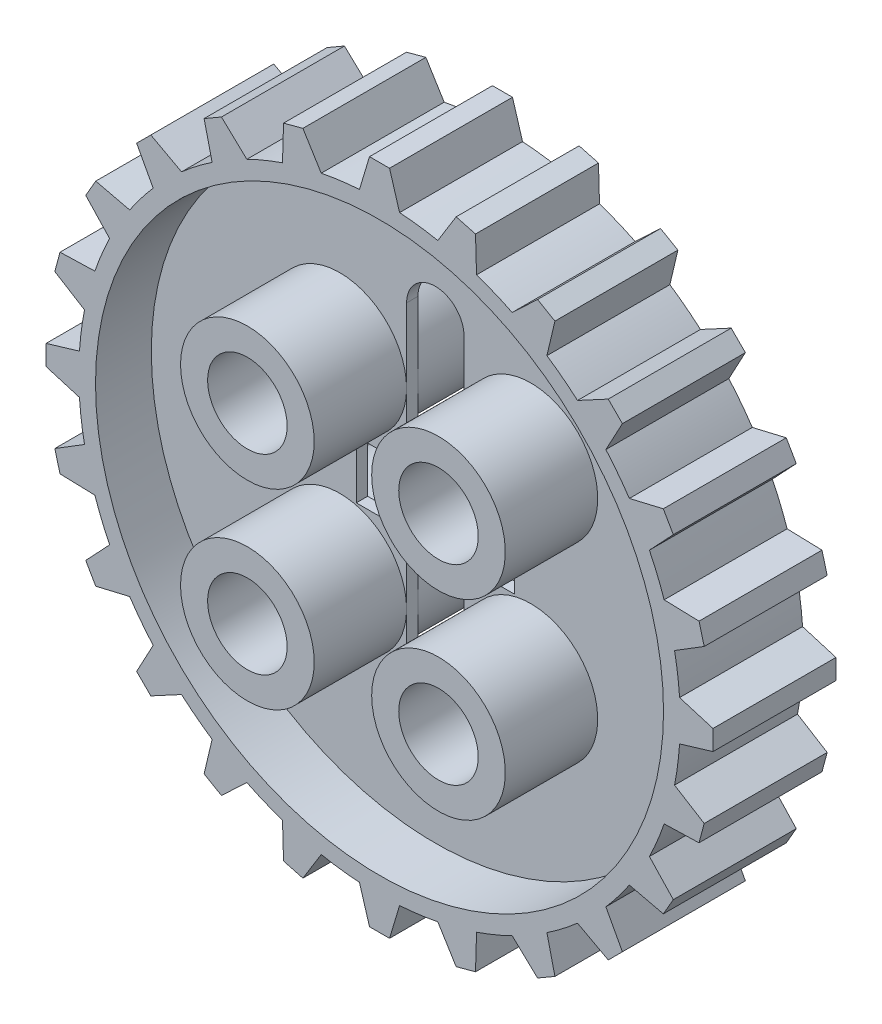
from build123d import *

# Parameters (mm, degrees)
BOSS_EXTRUDE1_DEPTH = 3.68
SKETCH2_R           = 8.5
CUT_EXTRUDE1_DEPTH  = 1.67
CUT_EXTRUDE2_START  = -1.67
SKETCH3_R           = 8.5
CUT_EXTRUDE2_DEPTH  = 1.67
CUT_EXTRUDE3_DEPTH  = 15.256227093
SKETCH17_8_R        = 2
SKETCH17_8_R_2      = 1.19
BOSS_EXTRUDE6_DEPTH = 3.105


with BuildPart() as part:
    # Sketch1 → Boss-Extrude1 (new body)
    with BuildSketch(Plane.XY):
        with BuildLine():
            Line((0.6, 8.979977728), (0.3, 9.979977728))
            Line((0.3, 9.979977728), (-0.3, 9.979977728))
            Line((-0.3, 9.979977728), (-0.6, 8.979977728))
            ThreePointArc((-0.6, 8.979977728), (-1.17473573, 8.923003752), (-1.744633765, 8.829283834))
            Line((-1.744633765, 8.829283834), (-2.293230558, 9.717563947))
            Line((-2.293230558, 9.717563947), (-2.872786054, 9.56227252))
            Line((-2.872786054, 9.56227252), (-2.903744756, 8.51870098))
            ThreePointArc((-2.903744756, 8.51870098), (-3.444150891, 8.314915793), (-3.970373622, 8.076888838))
            Line((-3.970373622, 8.076888838), (-4.730181243, 8.792914242))
            Line((-4.730181243, 8.792914242), (-5.249796485, 8.492914242))
            Line((-5.249796485, 8.492914242), (-5.009604106, 7.476888838))
            ThreePointArc((-5.009604106, 7.476888838), (-5.478852861, 7.140180063), (-5.925539078, 6.774067215))
            Line((-5.925539078, 6.774067215), (-6.844777893, 7.269041962))
            Line((-6.844777893, 7.269041962), (-7.269041962, 6.844777893))
            Line((-7.269041962, 6.844777893), (-6.774067215, 5.925539078))
            ThreePointArc((-6.774067215, 5.925539078), (-7.140180063, 5.478852861), (-7.476888838, 5.009604106))
            Line((-7.476888838, 5.009604106), (-8.492914242, 5.249796485))
            Line((-8.492914242, 5.249796485), (-8.792914242, 4.730181243))
            Line((-8.792914242, 4.730181243), (-8.076888838, 3.970373622))
            ThreePointArc((-8.076888838, 3.970373622), (-8.314915793, 3.444150891), (-8.51870098, 2.903744756))
            Line((-8.51870098, 2.903744756), (-9.56227252, 2.872786054))
            Line((-9.56227252, 2.872786054), (-9.717563947, 2.293230558))
            Line((-9.717563947, 2.293230558), (-8.829283834, 1.744633765))
            ThreePointArc((-8.829283834, 1.744633765), (-8.923003752, 1.17473573), (-8.979977728, 0.6))
            Line((-8.979977728, 0.6), (-9.979977728, 0.3))
            Line((-9.979977728, 0.3), (-9.979977728, -0.3))
            Line((-9.979977728, -0.3), (-8.979977728, -0.6))
            ThreePointArc((-8.979977728, -0.6), (-8.923003752, -1.17473573), (-8.829283834, -1.744633765))
            Line((-8.829283834, -1.744633765), (-9.717563947, -2.293230558))
            Line((-9.717563947, -2.293230558), (-9.56227252, -2.872786054))
            Line((-9.56227252, -2.872786054), (-8.51870098, -2.903744756))
            ThreePointArc((-8.51870098, -2.903744756), (-8.314915793, -3.444150891), (-8.076888838, -3.970373622))
            Line((-8.076888838, -3.970373622), (-8.792914242, -4.730181243))
            Line((-8.792914242, -4.730181243), (-8.492914242, -5.249796485))
            Line((-8.492914242, -5.249796485), (-7.476888838, -5.009604106))
            ThreePointArc((-7.476888838, -5.009604106), (-7.140180063, -5.478852861), (-6.774067215, -5.925539078))
            Line((-6.774067215, -5.925539078), (-7.269041962, -6.844777893))
            Line((-7.269041962, -6.844777893), (-6.844777893, -7.269041962))
            Line((-6.844777893, -7.269041962), (-5.925539078, -6.774067215))
            ThreePointArc((-5.925539078, -6.774067215), (-5.478852861, -7.140180063), (-5.009604106, -7.476888838))
            Line((-5.009604106, -7.476888838), (-5.249796485, -8.492914242))
            Line((-5.249796485, -8.492914242), (-4.730181243, -8.792914242))
            Line((-4.730181243, -8.792914242), (-3.970373622, -8.076888838))
            ThreePointArc((-3.970373622, -8.076888838), (-3.444150891, -8.314915793), (-2.903744756, -8.51870098))
            Line((-2.903744756, -8.51870098), (-2.872786054, -9.56227252))
            Line((-2.872786054, -9.56227252), (-2.293230558, -9.717563947))
            Line((-2.293230558, -9.717563947), (-1.744633765, -8.829283834))
            ThreePointArc((-1.744633765, -8.829283834), (-1.17473573, -8.923003752), (-0.6, -8.979977728))
            Line((-0.6, -8.979977728), (-0.3, -9.979977728))
            Line((-0.3, -9.979977728), (0.3, -9.979977728))
            Line((0.3, -9.979977728), (0.6, -8.979977728))
            ThreePointArc((0.6, -8.979977728), (1.17473573, -8.923003752), (1.744633765, -8.829283834))
            Line((1.744633765, -8.829283834), (2.293230558, -9.717563947))
            Line((2.293230558, -9.717563947), (2.872786054, -9.56227252))
            Line((2.872786054, -9.56227252), (2.903744756, -8.51870098))
            ThreePointArc((2.903744756, -8.51870098), (3.444150891, -8.314915793), (3.970373622, -8.076888838))
            Line((3.970373622, -8.076888838), (4.730181243, -8.792914242))
            Line((4.730181243, -8.792914242), (5.249796485, -8.492914242))
            Line((5.249796485, -8.492914242), (5.009604106, -7.476888838))
            ThreePointArc((5.009604106, -7.476888838), (5.478852861, -7.140180063), (5.925539078, -6.774067215))
            Line((5.925539078, -6.774067215), (6.844777893, -7.269041962))
            Line((6.844777893, -7.269041962), (7.269041962, -6.844777893))
            Line((7.269041962, -6.844777893), (6.774067215, -5.925539078))
            ThreePointArc((6.774067215, -5.925539078), (7.140180063, -5.478852861), (7.476888838, -5.009604106))
            Line((7.476888838, -5.009604106), (8.492914242, -5.249796485))
            Line((8.492914242, -5.249796485), (8.792914242, -4.730181243))
            Line((8.792914242, -4.730181243), (8.076888838, -3.970373622))
            ThreePointArc((8.076888838, -3.970373622), (8.314915793, -3.444150891), (8.51870098, -2.903744756))
            Line((8.51870098, -2.903744756), (9.56227252, -2.872786054))
            Line((9.56227252, -2.872786054), (9.717563947, -2.293230558))
            Line((9.717563947, -2.293230558), (8.829283834, -1.744633765))
            ThreePointArc((8.829283834, -1.744633765), (8.923003752, -1.17473573), (8.979977728, -0.6))
            Line((8.979977728, -0.6), (9.979977728, -0.3))
            Line((9.979977728, -0.3), (9.979977728, 0.3))
            Line((9.979977728, 0.3), (8.979977728, 0.6))
            ThreePointArc((8.979977728, 0.6), (8.923003752, 1.17473573), (8.829283834, 1.744633765))
            Line((8.829283834, 1.744633765), (9.717563947, 2.293230558))
            Line((9.717563947, 2.293230558), (9.56227252, 2.872786054))
            Line((9.56227252, 2.872786054), (8.51870098, 2.903744756))
            ThreePointArc((8.51870098, 2.903744756), (8.314915793, 3.444150891), (8.076888838, 3.970373622))
            Line((8.076888838, 3.970373622), (8.792914242, 4.730181243))
            Line((8.792914242, 4.730181243), (8.492914242, 5.249796485))
            Line((8.492914242, 5.249796485), (7.476888838, 5.009604106))
            ThreePointArc((7.476888838, 5.009604106), (7.140180063, 5.478852861), (6.774067215, 5.925539078))
            Line((6.774067215, 5.925539078), (7.269041962, 6.844777893))
            Line((7.269041962, 6.844777893), (6.844777893, 7.269041962))
            Line((6.844777893, 7.269041962), (5.925539078, 6.774067215))
            ThreePointArc((5.925539078, 6.774067215), (5.478852861, 7.140180063), (5.009604106, 7.476888838))
            Line((5.009604106, 7.476888838), (5.249796485, 8.492914242))
            Line((5.249796485, 8.492914242), (4.730181243, 8.792914242))
            Line((4.730181243, 8.792914242), (3.970373622, 8.076888838))
            ThreePointArc((3.970373622, 8.076888838), (3.444150891, 8.314915793), (2.903744756, 8.51870098))
            Line((2.903744756, 8.51870098), (2.872786054, 9.56227252))
            Line((2.872786054, 9.56227252), (2.293230558, 9.717563947))
            Line((2.293230558, 9.717563947), (1.744633765, 8.829283834))
            ThreePointArc((1.744633765, 8.829283834), (1.17473573, 8.923003752), (0.6, 8.979977728))
        make_face()
    extrude(amount=BOSS_EXTRUDE1_DEPTH)

    # Sketch2 → Cut-Extrude1 (cut)
    with BuildSketch(Plane.XY.offset(3.68)):
        Circle(SKETCH2_R)
    extrude(amount=-CUT_EXTRUDE1_DEPTH, mode=Mode.SUBTRACT)

    # Sketch3 → Cut-Extrude2 (cut)
    with BuildSketch(Plane(origin=(0, 0, 0), x_dir=(-1, 0, 0), z_dir=(0, 0, -1)).offset(CUT_EXTRUDE2_START)):
        Circle(SKETCH3_R)
    extrude(amount=CUT_EXTRUDE2_DEPTH, mode=Mode.SUBTRACT)

    # Sketch17 → Cut-Extrude3 (cut, through all)
    with BuildSketch(Plane(origin=(0, 0, 1.67), x_dir=(-1, 0, 0), z_dir=(0, 0, -1))):
        with BuildLine():
            ThreePointArc((-0.86, -5.075), (0, -5.935), (0.86, -5.075))
            Line((0.86, -5.075), (0.86, -0.86))
            Line((0.86, -0.86), (2.365, -0.86))
            Line((2.365, -0.86), (2.365, 0.86))
            Line((2.365, 0.86), (0.86, 0.86))
            Line((0.86, 0.86), (0.86, 5.075))
            ThreePointArc((0.86, 5.075), (0, 5.935), (-0.86, 5.075))
            Line((-0.86, 5.075), (-0.86, 0.86))
            Line((-0.86, 0.86), (-2.365, 0.86))
            Line((-2.365, 0.86), (-2.365, -0.86))
            Line((-2.365, -0.86), (-0.86, -0.86))
            Line((-0.86, -0.86), (-0.86, -5.075))
        make_face()
    extrude(amount=-CUT_EXTRUDE3_DEPTH, mode=Mode.SUBTRACT)

    # Sketch17<8> → Boss-Extrude6 (add, symmetric)
    # profile 1 of 4: a face of its own
    with BuildSketch(Plane(origin=(0, 0, 1.67), x_dir=(-1, 0, 0), z_dir=(0, 0, -1))):
        with Locations((-2.86, -2.86)):
            Circle(SKETCH17_8_R)
        with Locations((-2.86, -2.86)):
            Circle(SKETCH17_8_R_2, mode=Mode.SUBTRACT)
    # profile 2 of 4: a face of its own
    with BuildSketch(Plane(origin=(0, 0, 1.67), x_dir=(-1, 0, 0), z_dir=(0, 0, -1))):
        with Locations((2.86, -2.86)):
            Circle(SKETCH17_8_R)
        with Locations((2.86, -2.86)):
            Circle(SKETCH17_8_R_2, mode=Mode.SUBTRACT)
    # profile 3 of 4: a face of its own
    with BuildSketch(Plane(origin=(0, 0, 1.67), x_dir=(-1, 0, 0), z_dir=(0, 0, -1))):
        with Locations((-2.86, 2.86)):
            Circle(SKETCH17_8_R)
        with Locations((-2.86, 2.86)):
            Circle(SKETCH17_8_R_2, mode=Mode.SUBTRACT)
    # profile 4 of 4: a face of its own
    with BuildSketch(Plane(origin=(0, 0, 1.67), x_dir=(-1, 0, 0), z_dir=(0, 0, -1))):
        with Locations((2.86, 2.86)):
            Circle(SKETCH17_8_R)
        with Locations((2.86, 2.86)):
            Circle(SKETCH17_8_R_2, mode=Mode.SUBTRACT)
    extrude(amount=BOSS_EXTRUDE6_DEPTH, both=True)


solid = part.part
